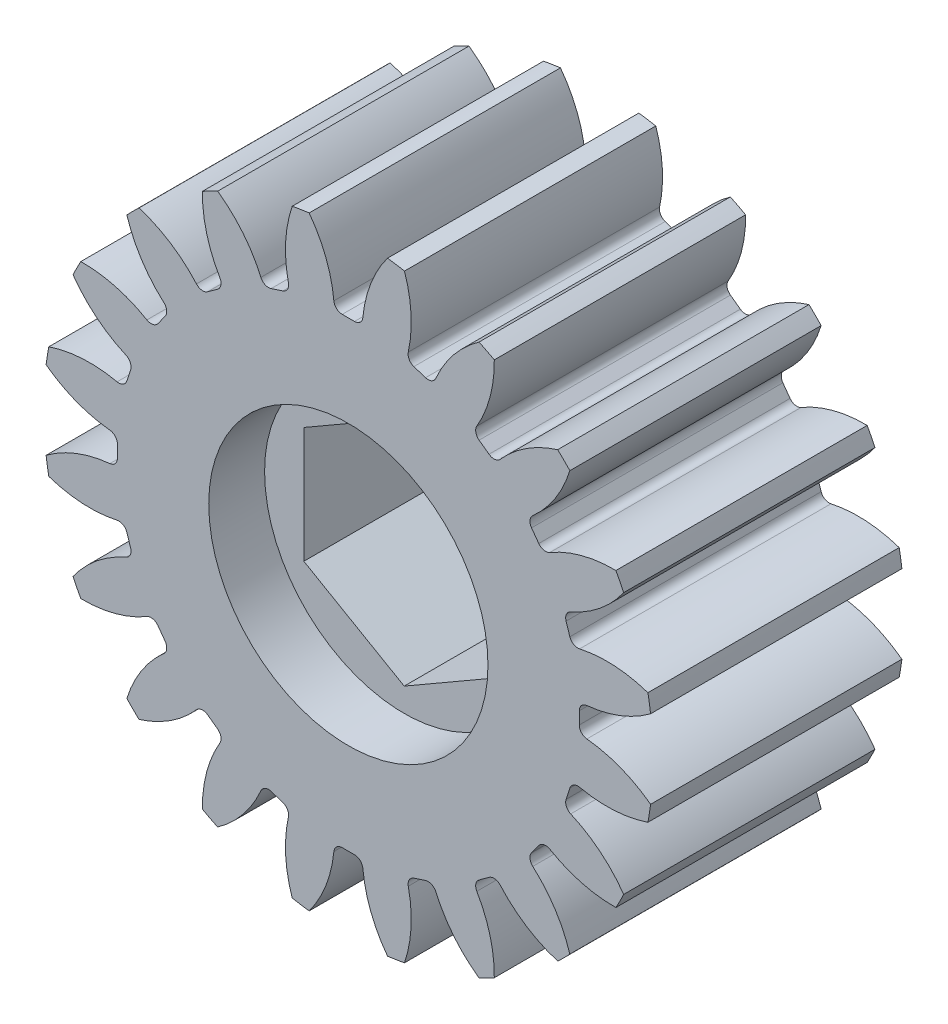
from build123d import *

# Parameters (mm, degrees)
SKIZZE1_R                       = 10.915
AUFSATZ_LINEAR_AUSTRAGEN1_DEPTH = 4.5
SKIZZE4_R                       = 5
SKIZZE4_R_2                     = 2.5
SCHNITT_LINEAR_AUSTRAGEN2_DEPTH = 2
SCHNITT_LINEAR_AUSTRAGEN3_DEPTH = 18.868252573
KREISMUSTER1_COUNT              = 20
SKIZZE8_R                       = 6
AUFSATZ_LINEAR_AUSTRAGEN2_DEPTH = 1
SCHNITT_LINEAR_AUSTRAGEN4_DEPTH = 19.284854719


with BuildPart() as part:
    # Skizze1 → Aufsatz-Linear austragen1 (new, symmetric)
    with BuildSketch(Plane.XY):
        Circle(SKIZZE1_R)
    extrude(amount=AUFSATZ_LINEAR_AUSTRAGEN1_DEPTH, both=True)

    # Skizze4 → Schnitt-Linear austragen2 (cut)
    with BuildSketch(Plane.XY.offset(4.5)):
        Circle(SKIZZE4_R)
        Circle(SKIZZE4_R_2, mode=Mode.SUBTRACT)
    extrude(amount=-SCHNITT_LINEAR_AUSTRAGEN2_DEPTH, mode=Mode.SUBTRACT)

    # Skizze6 → Schnitt-Linear austragen3 (cut, through all)
    with BuildSketch(Plane.XY.offset(4.5)):
        with BuildLine():
            Line((-0.219874756, 8.27), (0.219874756, 8.27))
            ThreePointArc((0.219874756, 8.27), (0.421386888, 8.347754953), (0.518441911, 8.540714262))
            ThreePointArc((0.518441911, 8.540714262), (1.009154991, 10.195876188), (2.08, 11.55))
            ThreePointArc((2.08, 11.55), (0, 11.670581665), (-2.08, 11.55))
            ThreePointArc((-2.08, 11.55), (-1.009154991, 10.195876188), (-0.518441911, 8.540714262))
            ThreePointArc((-0.518441911, 8.540714262), (-0.421386888, 8.347754953), (-0.219874756, 8.27))
        make_face()
    schnitt_linear_austragen3 = extrude(amount=-SCHNITT_LINEAR_AUSTRAGEN3_DEPTH, mode=Mode.SUBTRACT)

    # Kreismuster1: Schnitt-Linear austragen3 ×20 about axis
    kreismuster1_axis = Axis((0, 0, 0), (0, 0, 1))
    for i in range(1, KREISMUSTER1_COUNT):
        add(schnitt_linear_austragen3.rotate(kreismuster1_axis, i * 360 / KREISMUSTER1_COUNT), mode=Mode.SUBTRACT)

    # Skizze8 → Aufsatz-Linear austragen2 (add)
    with BuildSketch(Plane(origin=(0, 0, -4.5), x_dir=(-1, 0, 0), z_dir=(0, 0, -1))):
        with Locations(Location((0, 0, 0), (0, 0, 180))):
            Circle(SKIZZE8_R)
    extrude(amount=AUFSATZ_LINEAR_AUSTRAGEN2_DEPTH)

    # Skizze7 → Schnitt-Linear austragen4 (cut, through all)
    with BuildSketch(Plane.XY.offset(4.5)):
        Polygon((0, 4.15), (-3.594005426, 2.075), (-3.594005426, -2.075), (0, -4.15), (3.594005426, -2.075), (3.594005426, 2.075), align=None)
    extrude(amount=-SCHNITT_LINEAR_AUSTRAGEN4_DEPTH, mode=Mode.SUBTRACT)


solid = part.part
